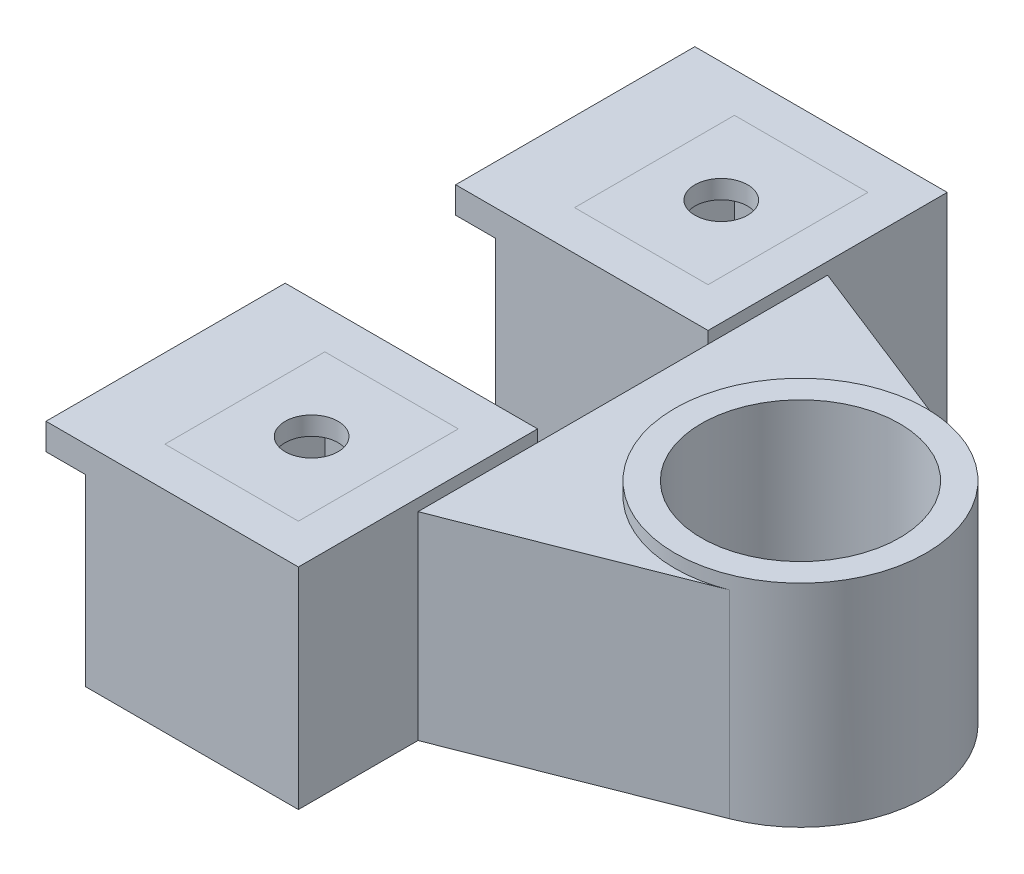
from build123d import *

# Parameters (mm, degrees)
SKETCH_1_R          = 2.5
EXTRUDE_1_DEPTH     = 5
SKETCH_2_R          = 9.5
EXTRUDE_2_DEPTH     = 16
CUT_EXTRUDE_1_DEPTH = 13.5
SKETCH_4_R          = 3.025
CUT_EXTRUDE_2_DEPTH = 6.5
SKETCH_5_R          = 3.525
CUT_EXTRUDE_3_DEPTH = 4.5
SKETCH_6_W          = 16.1
SKETCH_6_H          = 18.1
SKETCH_6_W_2        = 10.1
SKETCH_6_H_2        = 12.1
EXTRUDE_3_DEPTH     = 16
EXTRUDE_3_2_DEPTH   = 16
SKETCH_7_W          = 10.1
SKETCH_7_H          = 12.1
SKETCH_7_R          = 2
EXTRUDE_4_DEPTH     = 1.5
EXTRUDE_4_2_DEPTH   = 1.5
SKETCH_8_W          = 16.1
SKETCH_8_H          = 18.1
CUT_EXTRUDE_4_DEPTH = 0.1
EXTRUDE_START       = -15
EXTRUDE_5_DEPTH     = 15
SKETCH_10_R         = 7.5
CUT_EXTRUDE_6_DEPTH = 44.778549344
EXTRUDE_6_DEPTH     = 15.9
EXTRUDE_6_2_DEPTH   = 15.9
SKETCH_12_W         = 18.1
SKETCH_12_H         = 2
EXTRUDE_7_DEPTH     = 3


with BuildPart() as part:
    # Эскиз1 → Бобышка-Вытянуть1 (new body)
    with BuildSketch(Plane(origin=(0, 0, 0), x_dir=(1, 0, 0), z_dir=(0, 1, 0))):
        with Locations(Location((0, 0, 0), (0, 0, 270))):
            Circle(SKETCH_1_R)
    extrude(amount=EXTRUDE_1_DEPTH)

    # Эскиз2 → Бобышка-Вытянуть2 (add)
    with BuildSketch(Plane(origin=(0, 0, 0), x_dir=(1, 0, 0), z_dir=(0, 1, 0))):
        with Locations(Location((0, 0, 0), (0, 0, 270))):
            Circle(SKETCH_2_R)
    extrude(amount=-EXTRUDE_2_DEPTH)

    # Эскиз3 → Вырез-Вытянуть1 (cut)
    with BuildSketch(Plane.XZ.offset(16)):
        with BuildLine():
            Line((2.626904071, 1.5), (-2.626904071, 1.5))
            ThreePointArc((-2.626904071, 1.5), (-0.775963976, -2.923782637), (3.025, 0))
            ThreePointArc((3.025, 0), (2.923782637, 0.775963976), (2.626904071, 1.5))
        make_face()
    extrude(amount=-CUT_EXTRUDE_1_DEPTH, mode=Mode.SUBTRACT)

    # Эскиз4 → Вырез-Вытянуть2 (cut)
    with BuildSketch(Plane.XZ.offset(16)):
        with Locations(Location((0, 0, 0), (0, 0, 270))):
            Circle(SKETCH_4_R)
    extrude(amount=-CUT_EXTRUDE_2_DEPTH, mode=Mode.SUBTRACT)

    # Эскиз5 → Вырез-Вытянуть3 (cut)
    with BuildSketch(Plane.XZ.offset(16)):
        with Locations(Location((0, 0, 0), (0, 0, 270))):
            Circle(SKETCH_5_R)
    extrude(amount=-CUT_EXTRUDE_3_DEPTH, mode=Mode.SUBTRACT)



with BuildPart() as body_2:
    # Эскиз6 → Бобышка-Вытянуть3 (new body)
    with BuildSketch(Plane.XZ.offset(16)):
        with Locations((-21.49418526, -15.5)):
            Rectangle(SKETCH_6_W, SKETCH_6_H)
        with Locations((-21.49418526, -15.5)):
            Rectangle(SKETCH_6_W_2, SKETCH_6_H_2, mode=Mode.SUBTRACT)
    extrude(amount=-EXTRUDE_3_DEPTH)


with BuildPart() as body_3:
    # Эскиз6 → Extrude 3 2 (new body)
    with BuildSketch(Plane.XZ.offset(16)):
        with Locations((-21.49418526, 15.5)):
            Rectangle(SKETCH_6_W, SKETCH_6_H)
        with Locations((-21.49418526, 15.5)):
            Rectangle(SKETCH_6_W_2, SKETCH_6_H_2, mode=Mode.SUBTRACT)
    extrude(amount=-EXTRUDE_3_2_DEPTH)


with BuildPart() as body_4:
    # Эскиз7 → Бобышка-Вытянуть4 (new body)
    with BuildSketch(Plane(origin=(0, 0, 0), x_dir=(1, 0, 0), z_dir=(0, 1, 0))):
        with Locations((-21.49418526, 15.5)):
            Rectangle(SKETCH_7_W, SKETCH_7_H)
        with Locations(Location((-21.49418526, 15.5, 0), (0, 0, 270))):
            Circle(SKETCH_7_R, mode=Mode.SUBTRACT)
    extrude(amount=-EXTRUDE_4_DEPTH)


with BuildPart() as body_5:
    # Эскиз7 → Extrude 4 2 (new body)
    with BuildSketch(Plane(origin=(0, 0, 0), x_dir=(1, 0, 0), z_dir=(0, 1, 0))):
        with Locations((-21.49418526, -15.5)):
            Rectangle(SKETCH_7_W, SKETCH_7_H)
        with Locations(Location((-21.49418526, -15.5, 0), (0, 0, 270))):
            Circle(SKETCH_7_R, mode=Mode.SUBTRACT)
    extrude(amount=-EXTRUDE_4_2_DEPTH)


with BuildPart() as cut_extrude_4_tool:
    # Эскиз8 → Вырез-Вытянуть4 (new body)
    with BuildSketch(Plane(origin=(0, 0, 0), x_dir=(1, 0, 0), z_dir=(0, 1, 0))):
        with Locations((-21.49418526, 15.5)):
            Rectangle(SKETCH_8_W, SKETCH_8_H)
        with Locations((-21.49418526, -15.5)):
            Rectangle(SKETCH_8_W, SKETCH_8_H)
    extrude(amount=-CUT_EXTRUDE_4_DEPTH)


with BuildPart() as body_2_1:
    add(body_2.part)

    # Вырез-Вытянуть4: cut by cut_extrude_4_tool
    add(cut_extrude_4_tool.part, mode=Mode.SUBTRACT)


with BuildPart() as body_3_1:
    add(body_3.part)

    # Вырез-Вытянуть4: cut by cut_extrude_4_tool
    add(cut_extrude_4_tool.part, mode=Mode.SUBTRACT)


with BuildPart() as body_4_1:
    add(body_4.part)

    # Вырез-Вытянуть4: cut by cut_extrude_4_tool
    add(cut_extrude_4_tool.part, mode=Mode.SUBTRACT)


with BuildPart() as body_5_1:
    add(body_5.part)

    # Вырез-Вытянуть4: cut by cut_extrude_4_tool
    add(cut_extrude_4_tool.part, mode=Mode.SUBTRACT)


with BuildPart() as part_1:
    add(part.part)

    add(body_2_1.part)  # Бобышка-Вытянуть5 merges body 2

    add(body_3_1.part)  # Бобышка-Вытянуть5 merges body 3
    # Эскиз9 → Бобышка-Вытянуть5 (add)
    with BuildSketch(Plane.XZ.offset(16).offset(EXTRUDE_START)):
        with BuildLine():
            Line((-13.44418526, 15.5), (3.478924286, 8.840084039))
            ThreePointArc((3.478924286, 8.840084039), (-9.5, 0), (3.478924286, -8.840084039))
            Line((3.478924286, -8.840084039), (-13.44418526, -15.5))
            Line((-13.44418526, -15.5), (-13.44418526, 15.5))
        make_face()
    extrude(amount=EXTRUDE_5_DEPTH)

    # Эскиз10 → Вырез-Вытянуть6 (cut, through all)
    with BuildSketch(Plane.XZ.offset(16)):
        with Locations(Location((0, 0, 0), (0, 0, 270))):
            Circle(SKETCH_10_R)
    extrude(amount=-CUT_EXTRUDE_6_DEPTH, mode=Mode.SUBTRACT)



with BuildPart() as body_4_2:
    # Эскиз11 → Бобышка-Вытянуть6 (new body)
    with BuildSketch(Plane.XZ.offset(16)):
        Polygon((-29.54418526, 17.75), (-32.54418526, 19.5), (-32.54418526, 11.5), (-29.54418526, 13.25), align=None)
    extrude(amount=-EXTRUDE_6_DEPTH)


with BuildPart() as body_5_2:
    # Эскиз11 → Extrude 6 2 (new body)
    with BuildSketch(Plane.XZ.offset(16)):
        Polygon((-29.54418526, -13.25), (-32.54418526, -11.5), (-32.54418526, -19.5), (-29.54418526, -17.75), align=None)
    extrude(amount=-EXTRUDE_6_2_DEPTH)


with BuildPart() as part_2:
    add(part_1.part)

    add(body_4_2.part)  # Бобышка-Вытянуть7 merges body 4 2

    add(body_5_2.part)  # Бобышка-Вытянуть7 merges body 5 2
    # Эскиз12 → Бобышка-Вытянуть7 (add)
    with BuildSketch(Plane.ZY.offset(29.54418526)):
        with Locations((-15.5, -1.1)):
            Rectangle(SKETCH_12_W, SKETCH_12_H)
        with Locations((15.5, -1.1)):
            Rectangle(SKETCH_12_W, SKETCH_12_H)
    extrude(amount=EXTRUDE_7_DEPTH)


solid = Compound([body_4_1.part, body_5_1.part, part_2.part])
